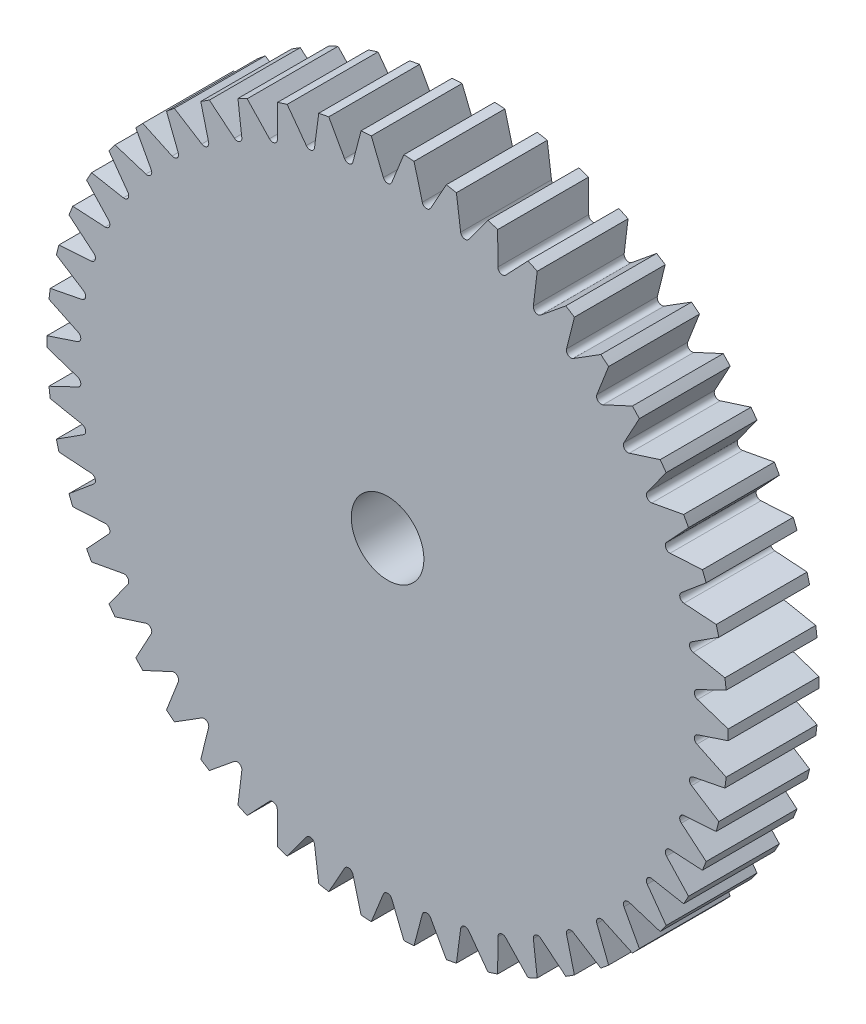
from build123d import *

# Parameters (mm, degrees)
SKETCH1_R           = 37.5
SKETCH1_R_2         = 4
BOSS_EXTRUDE1_DEPTH = 10
CUT_EXTRUDE1_DEPTH  = 54.967582862
CIRPATTERN1_COUNT   = 50


with BuildPart() as part:
    # Sketch1 → Boss-Extrude1 (new body)
    with BuildSketch(Plane.XY):
        Circle(SKETCH1_R)
        Circle(SKETCH1_R_2, mode=Mode.SUBTRACT)
    extrude(amount=BOSS_EXTRUDE1_DEPTH)

    # Sketch2 → Cut-Extrude1 (cut, through all)
    with BuildSketch(Plane.XY.offset(10)):
        with BuildLine():
            Line((-3.840395579, 42.539457832), (-0.463824544, 34.152129928))
            ThreePointArc((-0.463824544, 34.152129928), (0, 33.838856445), (0.463824544, 34.152129928))
            Line((0.463824544, 34.152129928), (3.840395579, 42.539457832))
            Line((3.840395579, 42.539457832), (-3.840395579, 42.539457832))
        make_face()
    cut_extrude1 = extrude(amount=-CUT_EXTRUDE1_DEPTH, mode=Mode.SUBTRACT)

    # CirPattern1: Cut-Extrude1 ×50 about axis
    cirpattern1_axis = Axis((0, 0, 0), (0, 0, 1))
    for i in range(1, CIRPATTERN1_COUNT):
        add(cut_extrude1.rotate(cirpattern1_axis, i * 360 / CIRPATTERN1_COUNT), mode=Mode.SUBTRACT)


solid = part.part
